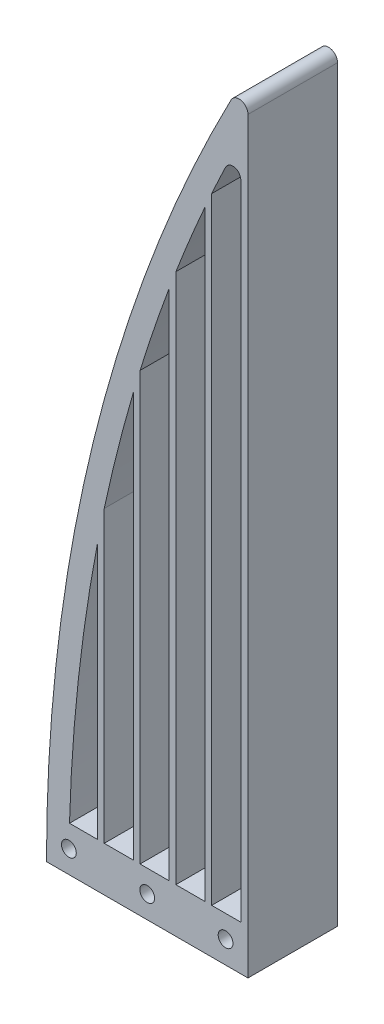
from build123d import *

# Parameters (mm, degrees)
BOSS_EXTRUDE4_DEPTH  = 20
SKETCH12_R           = 1.65
CUT_EXTRUDE1_DEPTH   = 177.068006068
SKETCH14_W           = 1.5
SKETCH14_H           = 148.56444562
BOSS_EXTRUDE5_DEPTH  = 20
CUT_EXTRUDE2_START   = -20
CUT_EXTRUDE2_DEPTH   = 20
CUT_EXTRUDE3_START   = -30
CUT_EXTRUDE3_DEPTH   = 30
LPATTERN2_COUNT      = 5
LPATTERN2_PITCH      = 8
LPATTERN2_COUNT_DIR2 = 5
LPATTERN2_PITCH_DIR2 = 8
CUT_EXTRUDE4_START   = -30
CUT_EXTRUDE4_DEPTH   = 30


with BuildPart() as part:
    # Sketch5 → Boss-Extrude4 (new body)
    with BuildSketch(Plane.XY):
        with BuildLine():
            Line((0, 0), (0, 167.041245738))
            ThreePointArc((0, 167.041245738), (-1.523254023, 168.9835931), (-3.772713274, 167.967252028))
            ThreePointArc((-3.772713274, 167.967252028), (-34.542452011, 86.476422979), (-45, 0))
            Line((-45, 0), (0, 0))
        make_face()
        with BuildLine():
            Line((-1.6, 10), (-39.860221142, 10))
            ThreePointArc((-39.860221142, 10), (-30.000299364, 83.996114978), (-5, 154.335493145))
            ThreePointArc((-5, 154.335493145), (-2.992115624, 155.307611869), (-1.6, 153.56444562))
            Line((-1.6, 153.56444562), (-1.6, 10))
        make_face(mode=Mode.SUBTRACT)
    extrude(amount=BOSS_EXTRUDE4_DEPTH)

    # Sketch12 → Cut-Extrude1 (cut, through all)
    with BuildSketch(Plane.XY.offset(20)):
        with Locations((-40, 5)):
            Circle(SKETCH12_R)
        with Locations((-22.5, 5)):
            Circle(SKETCH12_R)
        with Locations((-5, 5)):
            Circle(SKETCH12_R)
    extrude(amount=-CUT_EXTRUDE1_DEPTH, mode=Mode.SUBTRACT)

    # Sketch14 → Boss-Extrude5 (add)
    with BuildSketch(Plane.XY.offset(20)):
        with Locations((-0.85, 84.28222281)):
            Rectangle(SKETCH14_W, SKETCH14_H)
    boss_extrude5 = extrude(amount=-BOSS_EXTRUDE5_DEPTH)

    # Sketch17 → Cut-Extrude2 (cut)
    with BuildSketch(Plane.XY.offset(20).offset(CUT_EXTRUDE2_START)):
        Polygon((-120.638203698, 868.825955305), (-109.129206393, -31.174044695), (790.870793607, -19.66504739), (784.13367644, 507.175413991), align=None)
        with BuildLine():
            Line((-45, 0), (0, 0))
            Line((0, 0), (0, 167.041245738))
            ThreePointArc((0, 167.041245738), (-1.523254023, 168.9835931), (-3.772713274, 167.967252028))
            ThreePointArc((-3.772713274, 167.967252028), (-34.542452011, 86.476422979), (-45, 0))
        make_face(mode=Mode.SUBTRACT)
    extrude(amount=CUT_EXTRUDE2_DEPTH, mode=Mode.SUBTRACT)

    # Sketch18 → Cut-Extrude3 (cut)
    with BuildSketch(Plane.XY.offset(20).offset(CUT_EXTRUDE3_START)):
        Polygon((10.567687301, -7.152622061), (26.572035637, 318.782087337), (-234.729728554, 306.471050155), (-205.798791176, -46.855716973), align=None)
        with BuildLine():
            Line((-45, 0), (0, 0))
            Line((0, 0), (0, 167.041245738))
            ThreePointArc((0, 167.041245738), (-1.523254023, 168.9835931), (-3.772713274, 167.967252028))
            ThreePointArc((-3.772713274, 167.967252028), (-34.542452011, 86.476422979), (-45, 0))
        make_face(mode=Mode.SUBTRACT)
    extrude(amount=CUT_EXTRUDE3_DEPTH, mode=Mode.SUBTRACT)

    # LPattern2: Boss-Extrude5 5 × 5, 10 skipped
    with Locations(*[Vector(-1, 0, 0) * (i * LPATTERN2_PITCH) + Vector(-1, 0, 0) * (j * LPATTERN2_PITCH_DIR2) for i in range(LPATTERN2_COUNT) for j in range(LPATTERN2_COUNT_DIR2) if (i, j) not in ((0, 0), (1, 4), (2, 3), (2, 4), (3, 2), (3, 3), (3, 4), (4, 1), (4, 2), (4, 3), (4, 4))]):
        add(boss_extrude5)

    # Sketch19 → Cut-Extrude4 (cut)
    with BuildSketch(Plane.XY.offset(20).offset(CUT_EXTRUDE4_START)):
        Polygon((-113.909990018, -19.131609845), (183.246695872, -29.17634289), (134.697152825, 220.267861041), (-171.248674479, 235.334960607), align=None)
        with BuildLine():
            Line((-45, 0), (0, 0))
            Line((0, 0), (0, 167.041245738))
            ThreePointArc((0, 167.041245738), (-1.523254023, 168.9835931), (-3.772713274, 167.967252028))
            ThreePointArc((-3.772713274, 167.967252028), (-34.542452011, 86.476422979), (-45, 0))
        make_face(mode=Mode.SUBTRACT)
    extrude(amount=CUT_EXTRUDE4_DEPTH, mode=Mode.SUBTRACT)


solid = part.part
